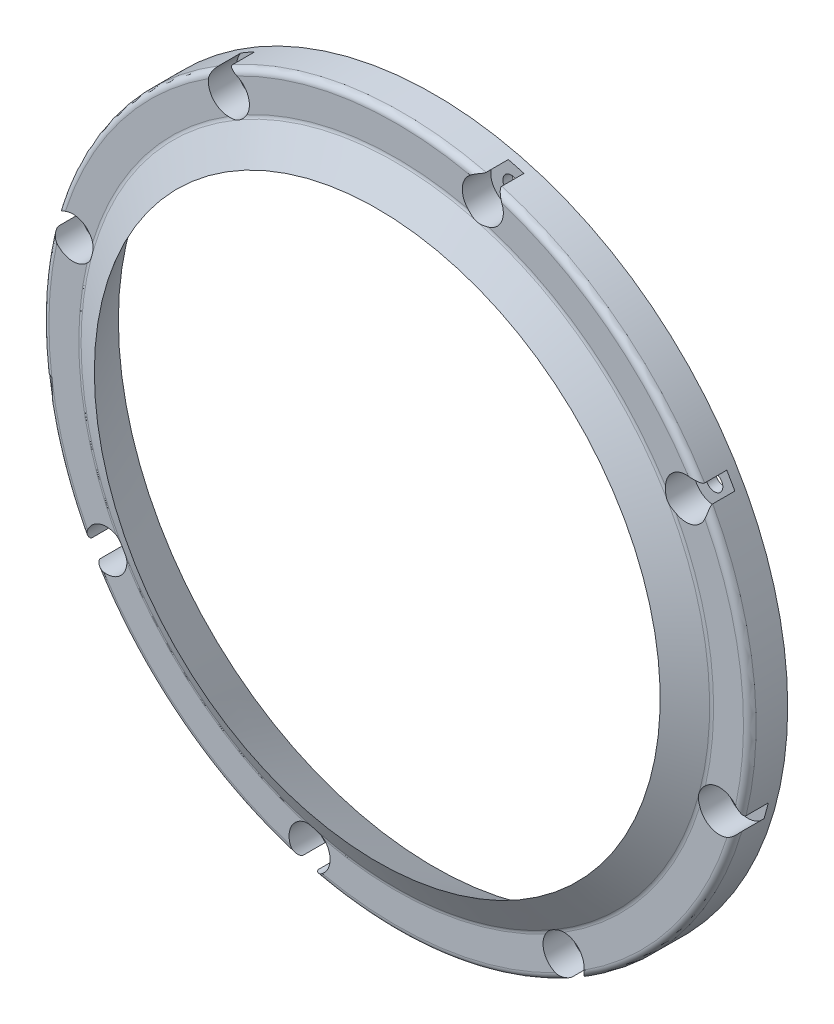
from build123d import *

# Parameters (mm, degrees)
FILLET1_R          = 2
SKETCH3_R          = 2.65
CUT_EXTRUDE1_DEPTH = 160.411417478
CUT_EXTRUDE2_START = -3
SKETCH4_R          = 6.5
CUT_EXTRUDE2_DEPTH = 157.411417478
CIRPATTERN1_COUNT  = 8


with BuildPart() as part:
    # Sketch2 → Revolve1 (revolve)
    with BuildSketch(Plane(origin=(0, 0, 0), x_dir=(1, 0, 0), z_dir=(0, 1, 0))):
        Polygon((-100, 0), (-112, 0), (-112, -12), (-100, -12), (-89.607695155, -18), align=None)
    revolve(axis=Axis((0, 0, 0), (0, 0, 1)))

    # Fillet1
    fillet1_edges = [part.edges().sort_by_distance(p)[0] for p in [
        (112, 0, 12),
        (100, 0, 12),
    ]]
    fillet(fillet1_edges, radius=FILLET1_R)

    # Sketch3 → Cut-Extrude1 (cut, through all)
    with BuildSketch(Plane(origin=(0, 0, 0), x_dir=(-1, 0, 0), z_dir=(0, 0, -1))):
        with Locations((-102.388137587, -27.434818781)):
            Circle(SKETCH3_R)
    cut_extrude1 = extrude(amount=-CUT_EXTRUDE1_DEPTH, mode=Mode.SUBTRACT)

    # Sketch4 → Cut-Extrude2 (cut, through all)
    with BuildSketch(Plane(origin=(0, 0, 0), x_dir=(-1, 0, 0), z_dir=(0, 0, -1)).offset(CUT_EXTRUDE2_START)):
        with Locations((-102.388137587, -27.434818781)):
            Circle(SKETCH4_R)
    cut_extrude2 = extrude(amount=-CUT_EXTRUDE2_DEPTH, mode=Mode.SUBTRACT)

    # CirPattern1: Cut-Extrude1, Cut-Extrude2 ×8 about axis
    cirpattern1_axis = Axis((0, 0, 0), (0, 0, 1))
    add([cut_extrude1.rotate(cirpattern1_axis, i * 360 / CIRPATTERN1_COUNT) for i in range(1, CIRPATTERN1_COUNT)], mode=Mode.SUBTRACT)
    add([cut_extrude2.rotate(cirpattern1_axis, i * 360 / CIRPATTERN1_COUNT) for i in range(1, CIRPATTERN1_COUNT)], mode=Mode.SUBTRACT)


solid = part.part
